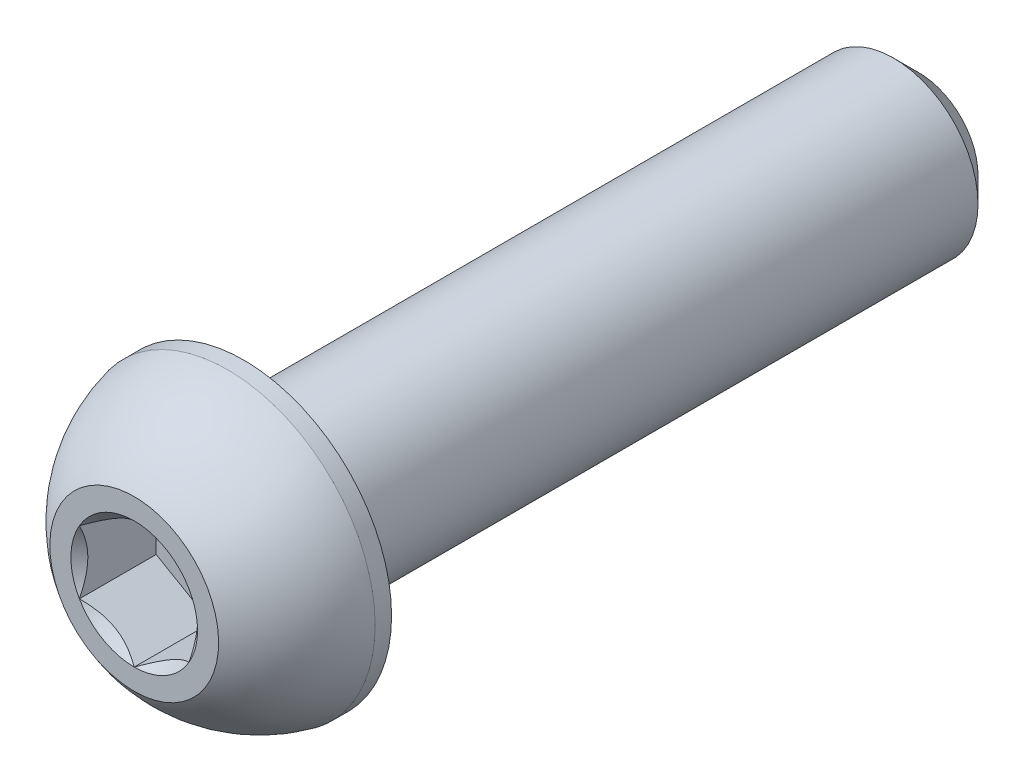
from build123d import *

# Parameters (mm, degrees)
CUT_EXTRUDE2_DEPTH = 0.91


with BuildPart() as part:
    # Sketch10 → Revolve3 (revolve)
    with BuildSketch(Plane(origin=(0, 0, 0), x_dir=(0, 0, -1), z_dir=(1, 0, 0))):
        Polygon((9, 1), (9.3, 0.7), (9.3, 0), (1.3, 0), (1.3, 1), align=None)
    revolve(axis=Axis((0, 0, 0), (0, 0, -1)))

    # Sketch7 → Revolve2 (revolve)
    with BuildSketch(Plane(origin=(0, 0, 0), x_dir=(0, 0, -1), z_dir=(1, 0, 0))):
        with BuildLine():
            Line((1.105, 1.75), (1.3, 1.75))
            Line((1.3, 1.75), (1.3, 0))
            Line((1.3, 0), (0, 0))
            Line((0, 0), (0, 1))
            ThreePointArc((0, 1), (0.479976957, 1.481850617), (1.105, 1.75))
        make_face()
    revolve(axis=Axis((0, 0, 0), (0, 0, -1)))

    # Sketch5 → Cut-Extrude2 (cut)
    with BuildSketch(Plane.XY):
        Polygon((0.65, -0.375277675), (0.65, 0.375277675), (0, 0.75055535), (-0.65, 0.375277675), (-0.65, -0.375277675), (0, -0.75055535), align=None)
    extrude(amount=-CUT_EXTRUDE2_DEPTH, mode=Mode.SUBTRACT)

    # Cut-Extrude3 cone 1 section (through the dimple's axis) → Cut-Extrude3 (revolve, cut)
    with BuildSketch(Plane(origin=(0, 0, 0), x_dir=(0, -1, 0), z_dir=(1, 0, 0))):
        Polygon((0, 0), (0.75055535, 0), (0, 0.75055535), align=None)
    revolve(axis=Axis((0, 0, 0), (0, 0, -1)), mode=Mode.SUBTRACT)


solid = part.part
